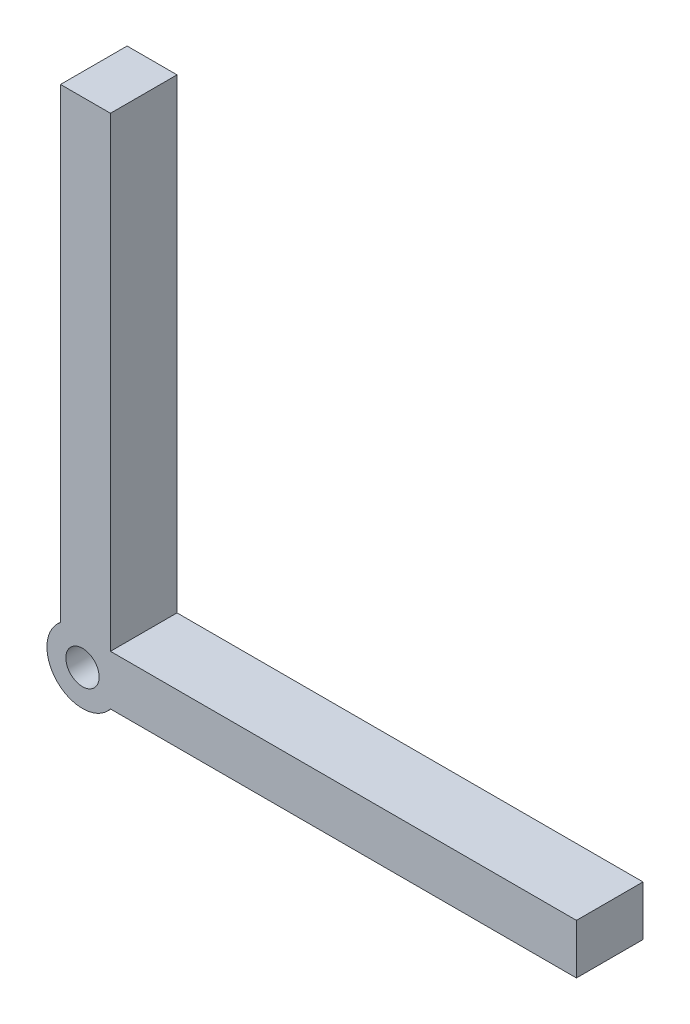
from build123d import *

# Parameters (mm, degrees)
BOSS_EXTRUDE2_DEPTH = 10
SKETCH2_R           = 2.5
CUT_EXTRUDE1_DEPTH  = 10


with BuildPart() as part:
    # Sketch1 → Boss-Extrude2 (new body)
    with BuildSketch(Plane.XY):
        with BuildLine():
            Line((-12.770888736, 48.650584459), (-12.770888736, -21.349415541))
            ThreePointArc((-12.770888736, -21.349415541), (-13.250610219, -29.329137023), (-5.270888736, -28.849415541))
            Line((-5.270888736, -28.849415541), (64.729111264, -28.849415541))
            Line((64.729111264, -28.849415541), (64.729111264, -21.349415541))
            Line((64.729111264, -21.349415541), (-5.270888736, -21.349415541))
            Line((-5.270888736, -21.349415541), (-5.270888736, 48.650584459))
            Line((-5.270888736, 48.650584459), (-12.770888736, 48.650584459))
        make_face()
    extrude(amount=BOSS_EXTRUDE2_DEPTH)

    # Sketch2 → Cut-Extrude1 (cut)
    with BuildSketch(Plane(origin=(0, 0, 0), x_dir=(-1, 0, 0), z_dir=(0, 0, -1))):
        with Locations((9.47340598, -25.551932785)):
            Circle(SKETCH2_R)
    extrude(amount=-CUT_EXTRUDE1_DEPTH, mode=Mode.SUBTRACT)


solid = part.part
